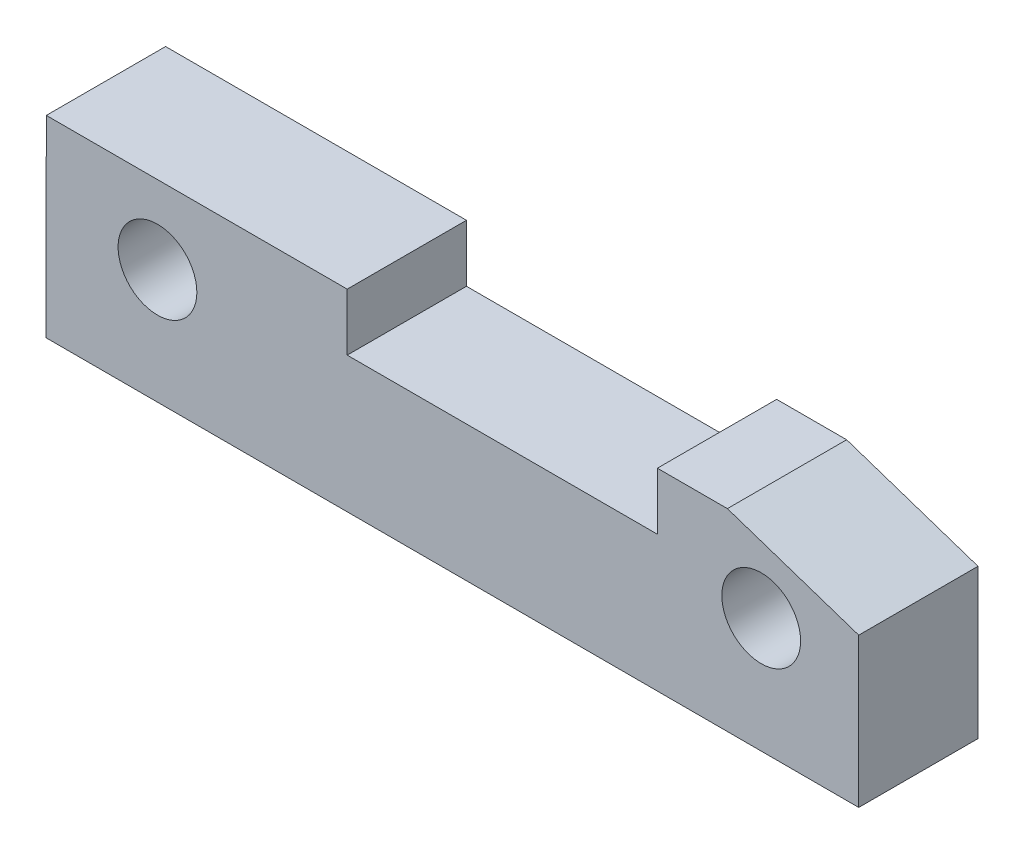
from build123d import *

# Parameters (mm, degrees)
BOSS_EXTRUDE1_DEPTH = 5
HOLES_R             = 1.650876527
HOLES_R_2           = 1.650891558
CUT_EXTRUDE1_DEPTH  = 36.37184843


with BuildPart() as part:
    # outline → Boss-Extrude1 (new body)
    with BuildSketch(Plane.XY):
        Polygon((0.012852413, 8.079831137), (12.627409632, 8.079831137), (12.627409632, 5.682741476), (25.630939629, 5.682741476), (25.630939629, 8.079831137), (28.565803795, 8.079831137), (34.071747683, 6.239460073), (34.071747683, -0.017512268), (0, 0), align=None)
    extrude(amount=-BOSS_EXTRUDE1_DEPTH)

    # holes → Cut-Extrude1 (cut, through all)
    with BuildSketch(Plane.XY):
        with Locations((4.673381995, 4.809052053)):
            Circle(HOLES_R)
        with Locations((29.983123795, 4.809407398)):
            Circle(HOLES_R_2)
    extrude(amount=-CUT_EXTRUDE1_DEPTH, mode=Mode.SUBTRACT)


solid = part.part
